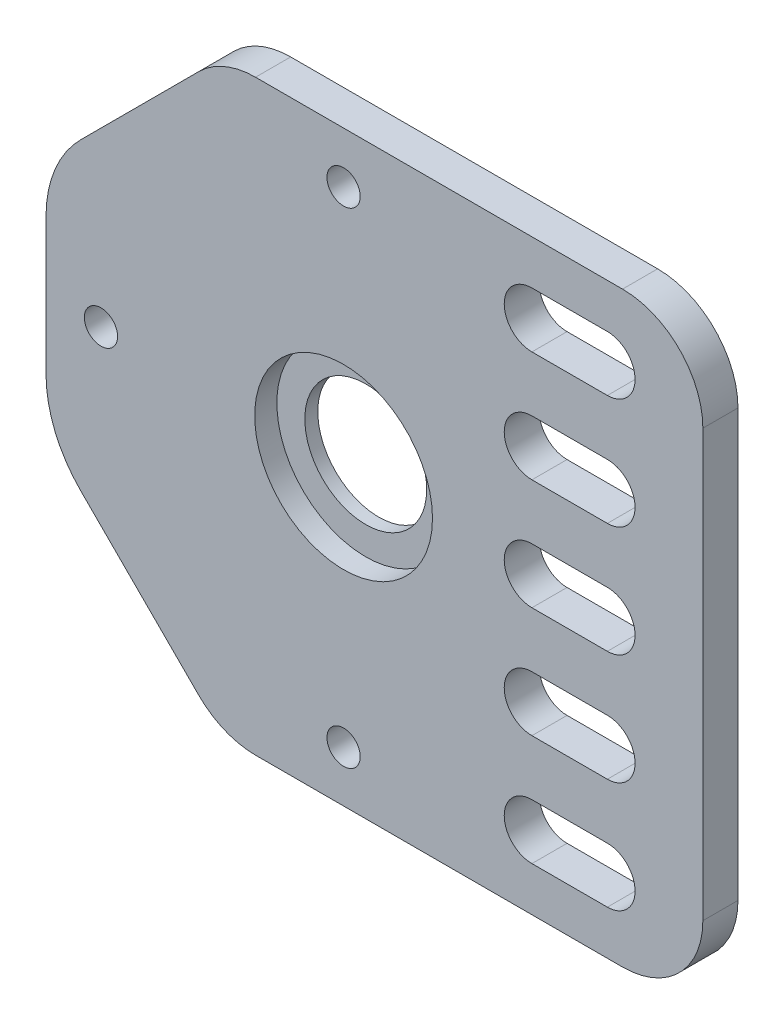
from build123d import *

# Parameters (mm, degrees)
ESQUISSE1_R             = 5.5
ESQUISSE1_R_2           = 1.5
BOSS_EXTRU_1_DEPTH      = 1.585
ESQUISSE2_R             = 8.025
ENL_V_MAT_EXTRU_1_DEPTH = 2


with BuildPart() as part:
    # Esquisse1 → Boss.-Extru.1 (new, symmetric)
    with BuildSketch(Plane.XY):
        with BuildLine():
            Line((25.18, -26.5), (-7.946951673, -26.5))
            ThreePointArc((-7.946951673, -26.5), (-10.721406557, -25.948126611), (-13.073475836, -24.376524164))
            Line((-13.073475836, -24.376524164), (-23.731900423, -13.718099577))
            ThreePointArc((-23.731900423, -13.718099577), (-26.047033407, -10.253258212), (-26.86, -6.166199154))
            Line((-26.86, -6.166199154), (-26.86, 6.166199154))
            ThreePointArc((-26.86, 6.166199154), (-26.047033407, 10.253258212), (-23.731900423, 13.718099577))
            Line((-23.731900423, 13.718099577), (-13.073475836, 24.376524164))
            ThreePointArc((-13.073475836, 24.376524164), (-10.721406557, 25.948126611), (-7.946951673, 26.5))
            Line((-7.946951673, 26.5), (25.18, 26.5))
            ThreePointArc((25.18, 26.5), (30.306524164, 24.376524164), (32.43, 19.25))
            Line((32.43, 19.25), (32.43, -19.25))
            ThreePointArc((32.43, -19.25), (30.306524164, -24.376524164), (25.18, -26.5))
        make_face()
        Circle(ESQUISSE1_R, mode=Mode.SUBTRACT)
        with Locations((0, 21.9)):
            Circle(ESQUISSE1_R_2, mode=Mode.SUBTRACT)
        with Locations((-21.9, 0)):
            Circle(ESQUISSE1_R_2, mode=Mode.SUBTRACT)
        with Locations((0, -21.9)):
            Circle(ESQUISSE1_R_2, mode=Mode.SUBTRACT)
        with BuildLine():
            Line((17, 22.5), (23.81, 22.5))
            ThreePointArc((23.81, 22.5), (26.31, 20), (23.81, 17.5))
            Line((23.81, 17.5), (17, 17.5))
            ThreePointArc((17, 17.5), (14.5, 20), (17, 22.5))
        make_face(mode=Mode.SUBTRACT)
        with BuildLine():
            Line((17, 12.5), (23.81, 12.5))
            ThreePointArc((23.81, 12.5), (26.31, 10), (23.81, 7.5))
            Line((23.81, 7.5), (17, 7.5))
            ThreePointArc((17, 7.5), (14.5, 10), (17, 12.5))
        make_face(mode=Mode.SUBTRACT)
        with BuildLine():
            Line((17, 2.5), (23.81, 2.5))
            ThreePointArc((23.81, 2.5), (26.31, 0), (23.81, -2.5))
            Line((23.81, -2.5), (17, -2.5))
            ThreePointArc((17, -2.5), (14.5, 0), (17, 2.5))
        make_face(mode=Mode.SUBTRACT)
        with BuildLine():
            Line((17, -7.5), (23.81, -7.5))
            ThreePointArc((23.81, -7.5), (26.31, -10), (23.81, -12.5))
            Line((23.81, -12.5), (17, -12.5))
            ThreePointArc((17, -12.5), (14.5, -10), (17, -7.5))
        make_face(mode=Mode.SUBTRACT)
        with BuildLine():
            Line((17, -17.5), (23.81, -17.5))
            ThreePointArc((23.81, -17.5), (26.31, -20), (23.81, -22.5))
            Line((23.81, -22.5), (17, -22.5))
            ThreePointArc((17, -22.5), (14.5, -20), (17, -17.5))
        make_face(mode=Mode.SUBTRACT)
    extrude(amount=BOSS_EXTRU_1_DEPTH, both=True)

    # Esquisse2 → Enlèv. mat.-Extru.1 (cut)
    with BuildSketch(Plane.XY.offset(1.585)):
        Circle(ESQUISSE2_R)
    extrude(amount=-ENL_V_MAT_EXTRU_1_DEPTH, mode=Mode.SUBTRACT)


solid = part.part
